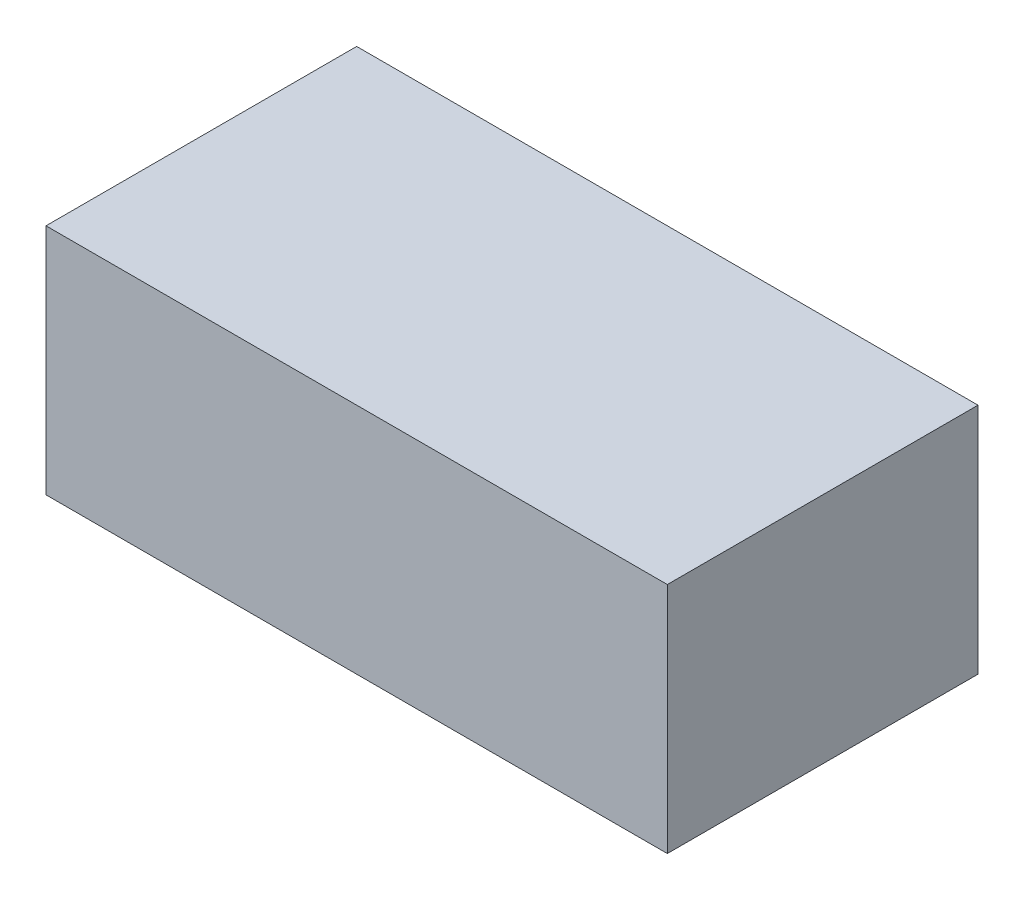
from build123d import *

# Parameters (mm, degrees)
SKETCH1_W           = 50.8
SKETCH1_H           = 25.4
BOSS_EXTRUDE1_DEPTH = 9.525


with BuildPart() as part:
    # Sketch1 → Boss-Extrude1 (new, symmetric)
    with BuildSketch(Plane(origin=(0, 0, 0), x_dir=(1, 0, 0), z_dir=(0, 1, 0))):
        Rectangle(SKETCH1_W, SKETCH1_H)
    extrude(amount=BOSS_EXTRUDE1_DEPTH, both=True)


solid = part.part
